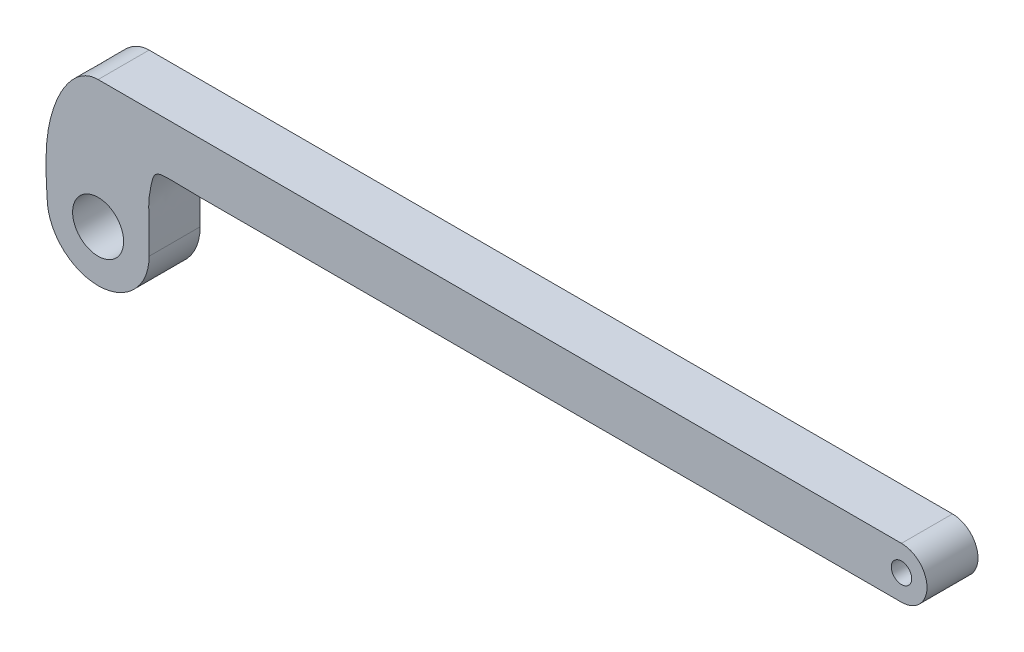
from build123d import *

# Parameters (mm, degrees)
SKETCH1_R           = 2
SKETCH1_R_2         = 5
BOSS_EXTRUDE1_DEPTH = 10


with BuildPart() as part:
    # Sketch1 → Boss-Extrude1 (new body)
    with BuildSketch(Plane(origin=(0, 0, 0), x_dir=(0, 1, 0), z_dir=(0, 0, 1))):
        with BuildLine():
            Line((25, 0), (25, -157.485))
            ThreePointArc((25, -157.485), (20, -162.485), (15, -157.485))
            Line((15, -157.485), (15, -20))
            add(Edge.make_bspline(
                [(0, -10), (6.790237035, -10), (8.986605454, -9.776088448), (16.124815875, -11.074928382), (15, -11.199503027), (15, -20)],
                knots=[0, 0, 0, 0, 0.182751564, 0.282751564, 1, 1, 1, 1], degree=3))
            ThreePointArc((0, -10), (-10, 0), (0, 10))
            add(Edge.make_bspline(
                [(0, 10), (0.681079819, 10), (14.239709664, 11.405780044), (25, 4.931387971), (25, 0)],
                knots=[0, 0, 0, 0, 0.356789172, 1, 1, 1, 1], degree=3))
        make_face()
        with Locations(Location((20, -157.485, 0), (0, 0, 270))):
            Circle(SKETCH1_R, mode=Mode.SUBTRACT)
        with Locations(Location((0, 0, 0), (0, 0, 270))):
            Circle(SKETCH1_R_2, mode=Mode.SUBTRACT)
    extrude(amount=BOSS_EXTRUDE1_DEPTH)


solid = part.part
